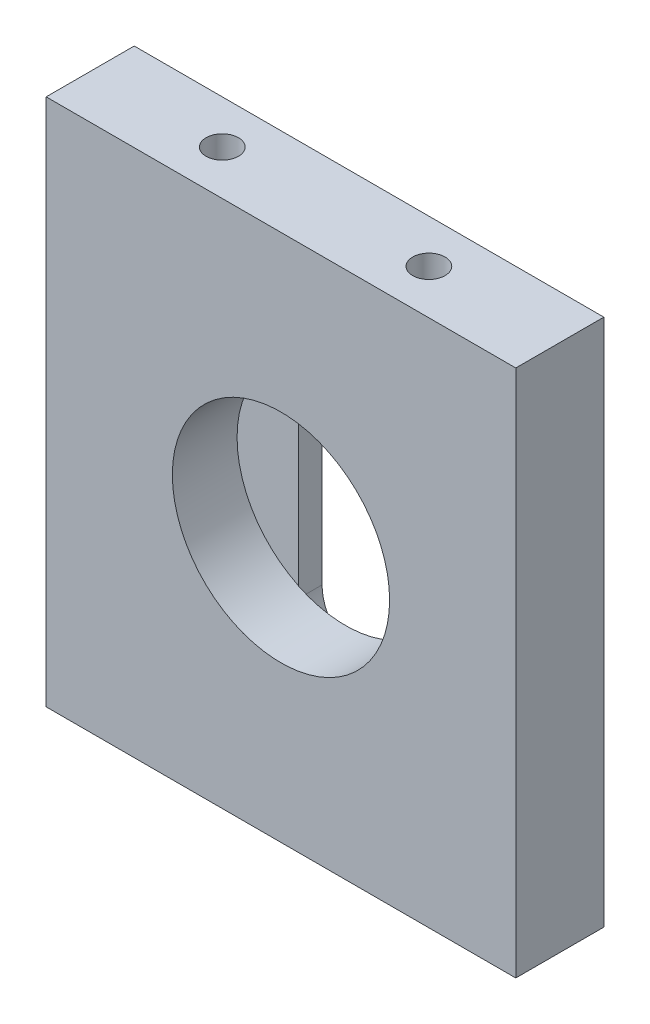
from build123d import *

# Parameters (mm, degrees)
SKETCH2_W                 = 114.3
SKETCH2_H                 = 101.6
BOSS_EXTRUDE2_DEPTH       = 19.05
M8X1_0_TAPPED_HOLE1_D     = 7
M8X1_0_TAPPED_HOLE1_DEPTH = 19.05
M8X1_0_TAPPED_HOLE1_TIP   = 2.103012167
M8X1_0_TAPPED_HOLE2_D     = 7
M8X1_0_TAPPED_HOLE2_DEPTH = 19.05
M8X1_0_TAPPED_HOLE2_TIP   = 2.103012167
SKETCH7_R                 = 23.5000038
CUT_EXTRUDE1_DEPTH        = 13.99999994
CUT_EXTRUDE5_DEPTH        = 5.08


with BuildPart() as part:
    # Sketch2 → Boss-Extrude2 (new body)
    with BuildSketch(Plane(origin=(0, 0, 0), x_dir=(0, 1, 0), z_dir=(0, 0, 1))):
        with Locations((57.15, 50.8)):
            Rectangle(SKETCH2_W, SKETCH2_H)
    extrude(amount=BOSS_EXTRUDE2_DEPTH)

    # M8x1.0 Tapped Hole1
    with Locations(Plane.XZ):
        with Locations((-28.448, 9.652), (-73.152, 9.652)):
            Hole(M8X1_0_TAPPED_HOLE1_D / 2, depth=M8X1_0_TAPPED_HOLE1_DEPTH)
            with Locations((0, 0, -(M8X1_0_TAPPED_HOLE1_DEPTH + M8X1_0_TAPPED_HOLE1_TIP / 2))):  # 118° drill point
                Cone(0, M8X1_0_TAPPED_HOLE1_D / 2, M8X1_0_TAPPED_HOLE1_TIP, mode=Mode.SUBTRACT)

    # M8x1.0 Tapped Hole2
    with Locations(Plane(origin=(0, 114.3, 0), x_dir=(-1, 0, 0), z_dir=(0, 1, 0))):
        with Locations((73.152, 9.398), (28.448, 9.398)):
            Hole(M8X1_0_TAPPED_HOLE2_D / 2, depth=M8X1_0_TAPPED_HOLE2_DEPTH)
            with Locations((0, 0, -(M8X1_0_TAPPED_HOLE2_DEPTH + M8X1_0_TAPPED_HOLE2_TIP / 2))):  # 118° drill point
                Cone(0, M8X1_0_TAPPED_HOLE2_D / 2, M8X1_0_TAPPED_HOLE2_TIP, mode=Mode.SUBTRACT)

    # Sketch7 → Cut-Extrude1 (cut)
    with BuildSketch(Plane.XY.offset(19.05)):
        with Locations((-50.8, 57.15)):
            Circle(SKETCH7_R)
    extrude(amount=-CUT_EXTRUDE1_DEPTH, mode=Mode.SUBTRACT)

    # Sketch8 → Cut-Extrude5 (cut)
    with BuildSketch(Plane(origin=(0, 0, 0), x_dir=(1, 0, 0), z_dir=(0, 0, -1))):
        with BuildLine():
            Line((-40.64, -33.6499962), (-40.64, -80.6500038))
            ThreePointArc((-40.64, -80.6500038), (-50.8, -90.8100038), (-60.96, -80.6500038))
            Line((-60.96, -80.6500038), (-60.96, -33.6499962))
            ThreePointArc((-60.96, -33.6499962), (-50.8, -23.4899962), (-40.64, -33.6499962))
        make_face()
    extrude(amount=-CUT_EXTRUDE5_DEPTH, mode=Mode.SUBTRACT)


solid = part.part
